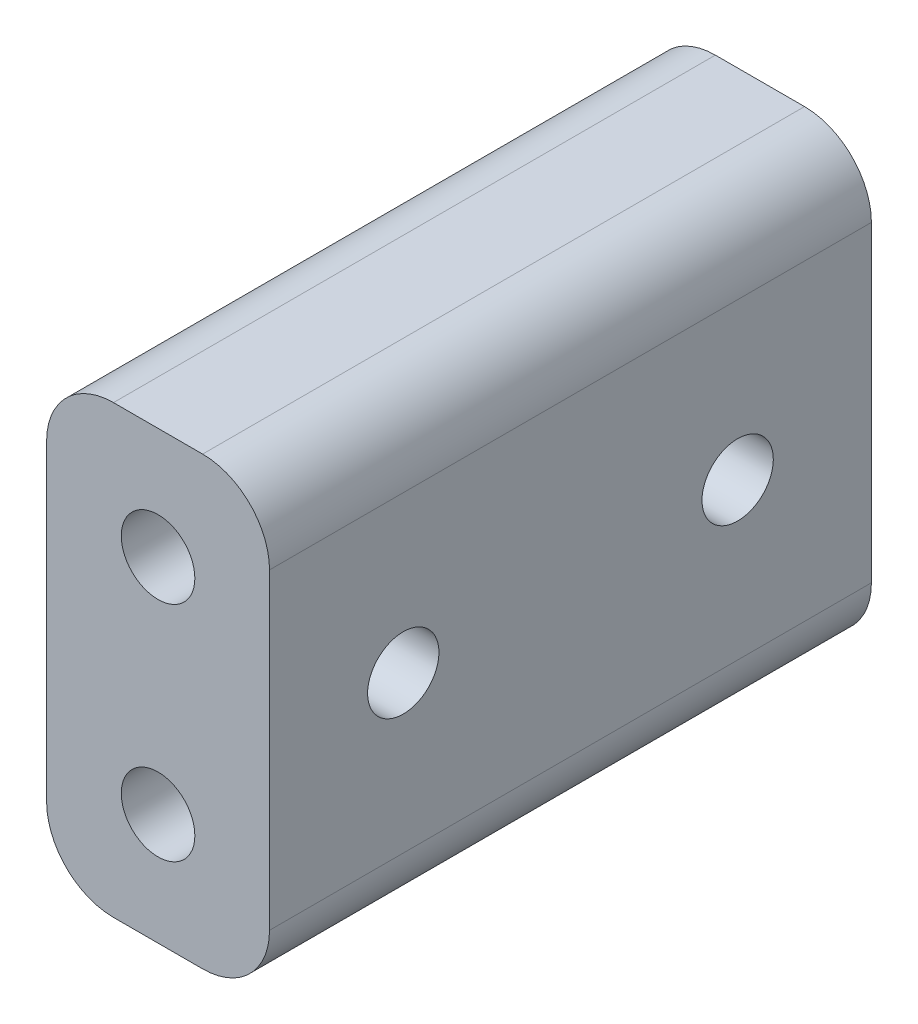
from build123d import *

# Parameters (mm, degrees)
SKETCH_1_W          = 10
SKETCH_1_H          = 20
SKETCH_1_R          = 1.65
EXTRUDE_1_DEPTH     = 27
FILLET_1_R          = 3
SKETCH_2_R          = 1.6
CUT_EXTRUDE_1_DEPTH = 36.057096286


with BuildPart() as part:
    # 草图1 → 凸台-拉伸1 (new body)
    with BuildSketch(Plane.XY):
        with Locations((5, -10)):
            Rectangle(SKETCH_1_W, SKETCH_1_H)
        with Locations((5, -5)):
            Circle(SKETCH_1_R, mode=Mode.SUBTRACT)
        with Locations((5, -15)):
            Circle(SKETCH_1_R, mode=Mode.SUBTRACT)
    extrude(amount=EXTRUDE_1_DEPTH)

    # 圆角1
    fillet_1_edges = [part.edges().sort_by_distance(p)[0] for p in [
        (0, 0, 13.5),
        (10, 0, 13.5),
        (10, -20, 13.5),
        (0, -20, 13.5),
    ]]
    fillet(fillet_1_edges, radius=FILLET_1_R)

    # 草图2 → 切除-拉伸1 (cut, through all)
    with BuildSketch(Plane(origin=(10, 0, 0), x_dir=(0, 0, -1), z_dir=(1, 0, 0))):
        with Locations(Location((-21, -10, 0), (0, 0, 90))):
            Circle(SKETCH_2_R)
        with Locations(Location((-6, -10, 0), (0, 0, 90))):
            Circle(SKETCH_2_R)
    extrude(amount=-CUT_EXTRUDE_1_DEPTH, mode=Mode.SUBTRACT)


solid = part.part
